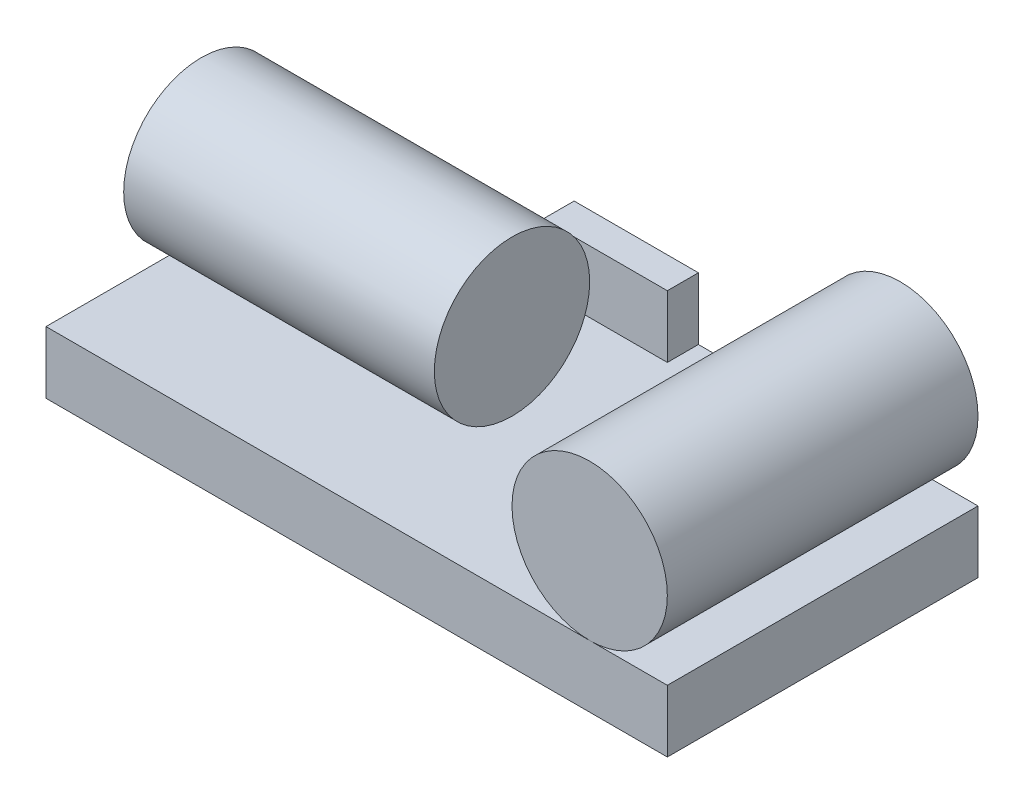
from build123d import *

# Parameters (mm, degrees)
SKETCH_1_W      = 20
SKETCH_1_H      = 10
EXTRUDE_1_DEPTH = 2
SKETCH_2_R      = 2.5
EXTRUDE_2_DEPTH = 10
SKETCH_3_R      = 2.5
EXTRUDE_3_DEPTH = 10
SKETCH_4_W      = 4
SKETCH_4_H      = 1
EXTRUDE_4_DEPTH = 2


with BuildPart() as part:
    # 草图1 → 凸台-拉伸1 (new body)
    with BuildSketch(Plane(origin=(0, 0, 0), x_dir=(1, 0, 0), z_dir=(0, 1, 0))):
        with Locations((10, 5)):
            Rectangle(SKETCH_1_W, SKETCH_1_H)
    extrude(amount=EXTRUDE_1_DEPTH)

    # 草图4 → 凸台-拉伸4 (add)
    with BuildSketch(Plane(origin=(0, 2, 0), x_dir=(1, 0, 0), z_dir=(0, 1, 0))):
        with Locations((9, 9.5)):
            Rectangle(SKETCH_4_W, SKETCH_4_H)
    extrude(amount=EXTRUDE_4_DEPTH)


with BuildPart() as body_2:
    # 草图2 → 凸台-拉伸2 (new body)
    with BuildSketch(Plane.XY):
        with Locations((17.5, 4.5)):
            Circle(SKETCH_2_R)
    extrude(amount=-EXTRUDE_2_DEPTH)


with BuildPart() as body_3:
    # 草图3 → 凸台-拉伸3 (new body)
    with BuildSketch(Plane.ZY):
        with Locations((-5, 4.5)):
            Circle(SKETCH_3_R)
    extrude(amount=-EXTRUDE_3_DEPTH)


solid = Compound([part.part, body_2.part, body_3.part])
